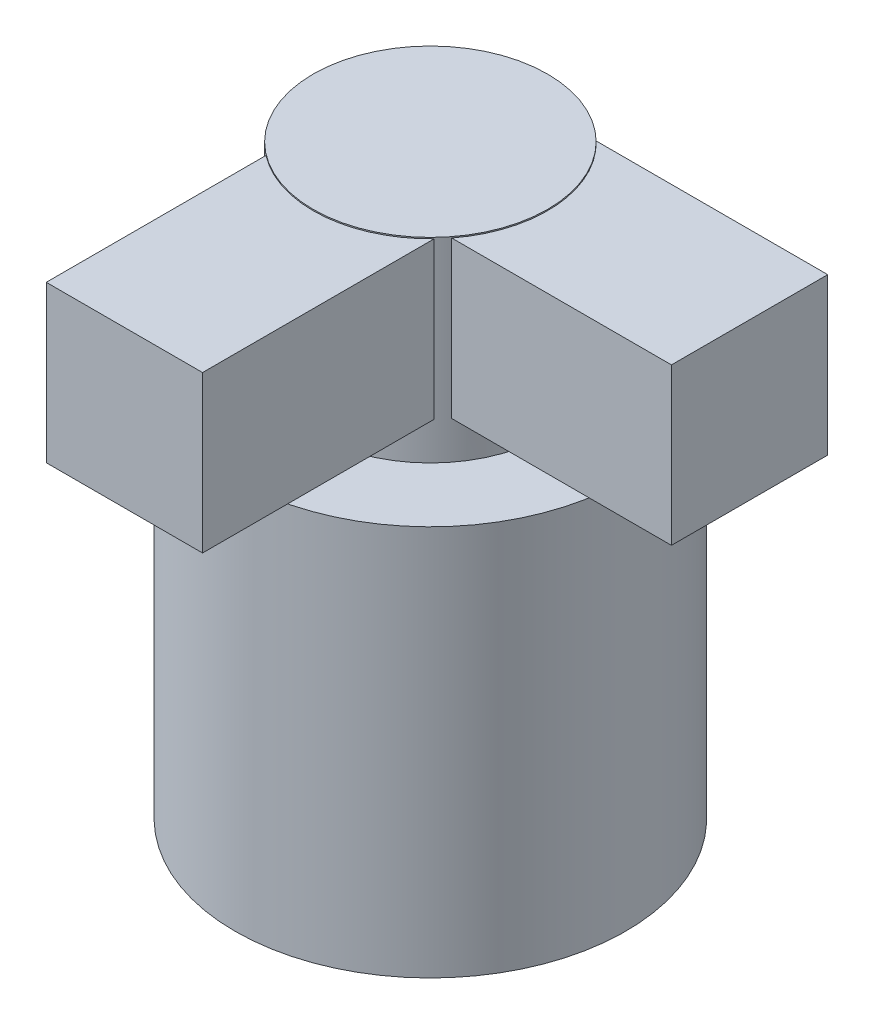
from build123d import *

# Parameters (mm, degrees)
SKETCH1_R           = 5
BOSS_EXTRUDE1_DEPTH = 10
SKETCH2_R           = 3
BOSS_EXTRUDE2_DEPTH = 5
SKETCH3_R           = 3
CUT_EXTRUDE1_DEPTH  = 5
SKETCH4_W           = 4
SKETCH4_H           = 4
BOSS_EXTRUDE3_DEPTH = 8
CIRPATTERN1_COUNT   = 2
CIRPATTERN1_ANGLE   = 90


with BuildPart() as part:
    # Sketch1 → Boss-Extrude1 (new body)
    with BuildSketch(Plane(origin=(0, 0, 0), x_dir=(1, 0, 0), z_dir=(0, 1, 0))):
        with Locations(Location((0, 0, 0), (0, 0, 270))):
            Circle(SKETCH1_R)
    extrude(amount=BOSS_EXTRUDE1_DEPTH)

    # Sketch2 → Boss-Extrude2 (add)
    with BuildSketch(Plane(origin=(0, 10, 0), x_dir=(1, 0, 0), z_dir=(0, 1, 0))):
        with Locations(Location((0, 0, 0), (0, 0, 270))):
            Circle(SKETCH2_R)
    extrude(amount=BOSS_EXTRUDE2_DEPTH)

    # Sketch3 → Cut-Extrude1 (cut)
    with BuildSketch(Plane.XZ):
        with Locations(Location((0, 0, 0), (0, 0, 90))):
            Circle(SKETCH3_R)
    extrude(amount=-CUT_EXTRUDE1_DEPTH, mode=Mode.SUBTRACT)

    # Sketch4 → Boss-Extrude3 (add)
    with BuildSketch(Plane.XY):
        with Locations((0.169651393, 12.969101694)):
            Rectangle(SKETCH4_W, SKETCH4_H)
    boss_extrude3 = extrude(amount=BOSS_EXTRUDE3_DEPTH)

    # CirPattern1: Boss-Extrude3 ×2 about axis
    cirpattern1_axis = Axis((0, 0, 0), (0, 1, 0))
    for i in range(1, CIRPATTERN1_COUNT):
        add(boss_extrude3.rotate(cirpattern1_axis, i * CIRPATTERN1_ANGLE / (CIRPATTERN1_COUNT - 1)))


solid = part.part
